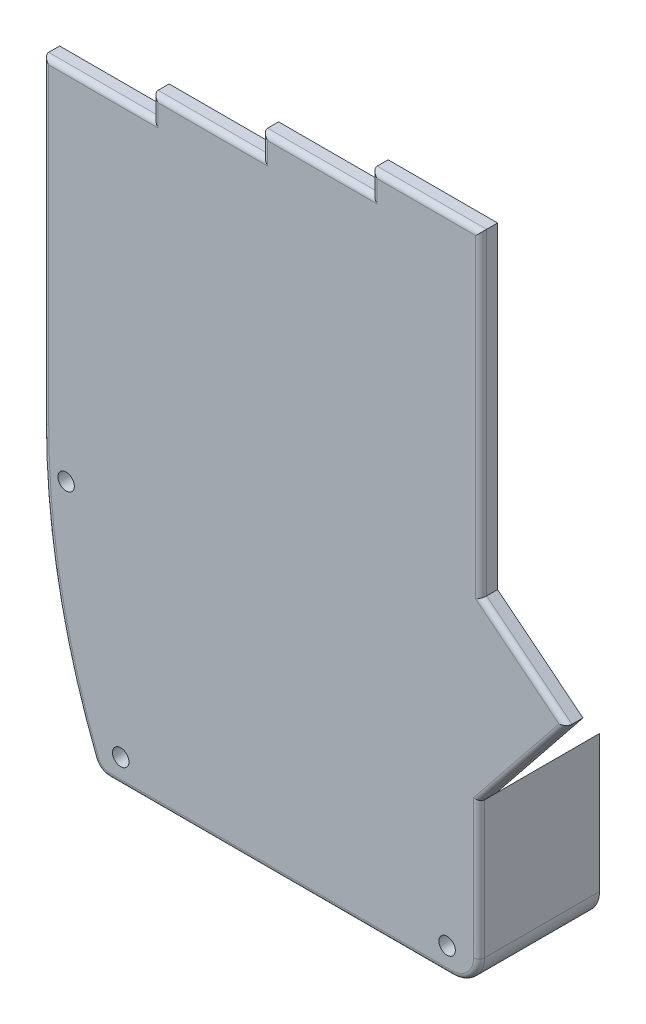
from build123d import *

# Parameters (mm, degrees)
BOSS_EXTRUDE1_DEPTH = 3
BOSS_EXTRUDE6_DEPTH = 22
CUT_EXTRUDE2_REACH  = 157.399
SKETCH23_R          = 1.5
FILLET2_R           = 1
SKETCH26_W          = 62.629754997
SKETCH26_H          = 21
BOSS_EXTRUDE8_DEPTH = 0.1
CUT_EXTRUDE4_REACH  = 155.098
SKETCH28_R          = 7


with BuildPart() as part:
    # Sketch1 → Boss-Extrude1 (new body)
    with BuildSketch(Plane.XY):
        with BuildLine():
            Line((0.088772672, 50.445513271), (0.088772672, 108.445513271))
            Line((0.088772672, 108.445513271), (20.088772672, 108.445513271))
            Line((20.088772672, 108.445513271), (20.088772672, 112.445513271))
            Line((20.088772672, 112.445513271), (40.088772672, 112.445513271))
            Line((40.088772672, 112.445513271), (40.088772672, 116.445513271))
            Line((40.088772672, 116.445513271), (60.088772672, 116.445513271))
            Line((60.088772672, 116.445513271), (60.088772672, 120.445513271))
            Line((60.088772672, 120.445513271), (80.088772672, 120.445513271))
            Line((80.088772672, 120.445513271), (80.088772672, 62.445513271))
            Line((80.088772672, 62.445513271), (95.696655206, 49.939754486))
            Line((95.696655206, 49.939754486), (79.719999866, 30))
            Line((79.719999866, 30), (79.719999866, 5))
            ThreePointArc((79.719999866, 5), (78.255533771, 1.464466094), (74.719999866, 0))
            Line((74.719999866, 0), (45.081340107, 0))
            Line((45.081340107, 0), (12.090244869, 0))
            ThreePointArc((12.090244869, 0), (10.402431062, 0.519821669), (9.299525382, 1.899143631))
            ThreePointArc((9.299525382, 1.899143631), (2.402932305, 25.737613543), (0.088772672, 50.445513271))
        make_face()
    extrude(amount=-BOSS_EXTRUDE1_DEPTH)

    # Sketch19 → Boss-Extrude6 (add)
    with BuildSketch(Plane.XY):
        with BuildLine():
            Line((45.081340107, 0), (12.090244869, 0))
            ThreePointArc((12.090244869, 0), (10.402431062, 0.519821669), (9.299525382, 1.899143631))
            ThreePointArc((9.299525382, 1.899143631), (2.402932305, 25.737613543), (0.088772672, 50.445513271))
            Line((0.088772672, 50.445513271), (3.088772672, 50.445513271))
            ThreePointArc((3.088772672, 50.445513271), (3.16127999, 48.288360754), (3.269039313, 46.132681692))
            Line((3.269039313, 46.132681692), (7.269039313, 46.132681692))
            Line((7.269039313, 46.132681692), (7.269039313, 41.132681692))
            Line((7.269039313, 41.132681692), (3.810920964, 39.61137507))
            ThreePointArc((3.810920964, 39.61137507), (6.552384593, 23.576295262), (11.244934046, 8.000050948))
            Line((11.244934046, 8.000050948), (18.244934046, 8.000050948))
            Line((18.244934046, 8.000050948), (18.244934046, 2.984064914))
            Line((18.244934046, 2.984064914), (45.23554431, 2.984064914))
            Line((45.23554431, 2.984064914), (69.874178677, 2.984064914))
            Line((69.874178677, 2.984064914), (69.874178677, 7.984064914))
            Line((69.874178677, 7.984064914), (76.874178677, 7.984064914))
            Line((76.874178677, 7.984064914), (76.933259672, 26.52199324))
            Line((76.933259672, 26.52199324), (79.719999866, 30))
            Line((79.719999866, 30), (79.719999866, 5))
            ThreePointArc((79.719999866, 5), (78.255533771, 1.464466094), (74.719999866, 0))
            Line((74.719999866, 0), (45.081340107, 0))
        make_face()
    extrude(amount=-BOSS_EXTRUDE6_DEPTH)

    # Sketch23 → Cut-Extrude2 (cut, up to next)
    with BuildSketch(Plane(origin=(0, 0, -22), x_dir=(-1, 0, 0), z_dir=(0, 0, -1)), mode=Mode.PRIVATE) as cut_extrude2_sk1:
        with Locations((-4.269039313, 43.132681692)):
            Circle(SKETCH23_R)
    cut_extrude2_tool1 = extrude(cut_extrude2_sk1.sketch, amount=-CUT_EXTRUDE2_REACH, mode=Mode.PRIVATE) & part.part
    # Sketch23 → Cut-Extrude2 (cut, up to next)
    with BuildSketch(Plane(origin=(0, 0, -22), x_dir=(-1, 0, 0), z_dir=(0, 0, -1)), mode=Mode.PRIVATE) as cut_extrude2_sk2:
        with Locations((-14.244934046, 4.500050948)):
            Circle(SKETCH23_R)
    cut_extrude2_tool2 = extrude(cut_extrude2_sk2.sketch, amount=-CUT_EXTRUDE2_REACH, mode=Mode.PRIVATE) & part.part
    # Sketch23 → Cut-Extrude2 (cut, up to next)
    with BuildSketch(Plane(origin=(0, 0, -22), x_dir=(-1, 0, 0), z_dir=(0, 0, -1)), mode=Mode.PRIVATE) as cut_extrude2_sk3:
        with Locations((-73.874178677, 4.484064914)):
            Circle(SKETCH23_R)
    cut_extrude2_tool3 = extrude(cut_extrude2_sk3.sketch, amount=-CUT_EXTRUDE2_REACH, mode=Mode.PRIVATE) & part.part
    add(cut_extrude2_tool1.solids().sort_by_distance((4.269039, 43.132682, -22))[0], mode=Mode.SUBTRACT)
    add(cut_extrude2_tool2.solids().sort_by_distance((14.244934, 4.500051, -22))[0], mode=Mode.SUBTRACT)
    add(cut_extrude2_tool3.solids().sort_by_distance((73.874179, 4.484065, -22))[0], mode=Mode.SUBTRACT)

    # Fillet2
    fillet2_edges = [part.edges().sort_by_distance(p)[0] for p in [
        (78.255533771, 1.464466094, 0),
        (43.405122367, 0, 0),
        (10.402431062, 0.519821669, 0),
        (2.402932305, 25.737613543, 0),
        (0.088772672, 79.445513271, 0),
        (10.088772672, 108.445513271, 0),
        (20.088772672, 110.445513271, 0),
        (30.088772672, 112.445513271, 0),
        (40.088772672, 114.445513271, 0),
        (50.088772672, 116.445513271, 0),
        (60.088772672, 118.445513271, 0),
        (70.088772672, 120.445513271, 0),
        (80.088772672, 91.445513271, 0),
        (87.892713939, 56.192633878, 0),
        (87.708327536, 39.969877243, 0),
        (79.719999866, 17.5, 0),
    ]]
    fillet(fillet2_edges, radius=FILLET2_R)

    # Sketch26 → Boss-Extrude8 (add)
    with BuildSketch(Plane.XZ):
        with Locations((43.405122368, -11.5)):
            Rectangle(SKETCH26_W, SKETCH26_H)
    extrude(amount=BOSS_EXTRUDE8_DEPTH)

    # Sketch28 → Cut-Extrude4 (cut, up to next)
    with BuildSketch(Plane(origin=(0, 2.984064914, 0), x_dir=(1, 0, 0), z_dir=(0, 1, 0)), mode=Mode.PRIVATE) as cut_extrude4_sk1:
        with Locations(Location((44.059556361, 12.5, 0), (0, 0, 180))):
            Circle(SKETCH28_R)
    cut_extrude4_tool1 = extrude(cut_extrude4_sk1.sketch, amount=-CUT_EXTRUDE4_REACH, mode=Mode.PRIVATE) & part.part
    add(cut_extrude4_tool1.solids().sort_by_distance((44.059556, 2.984065, -12.5))[0], mode=Mode.SUBTRACT)


solid = part.part
